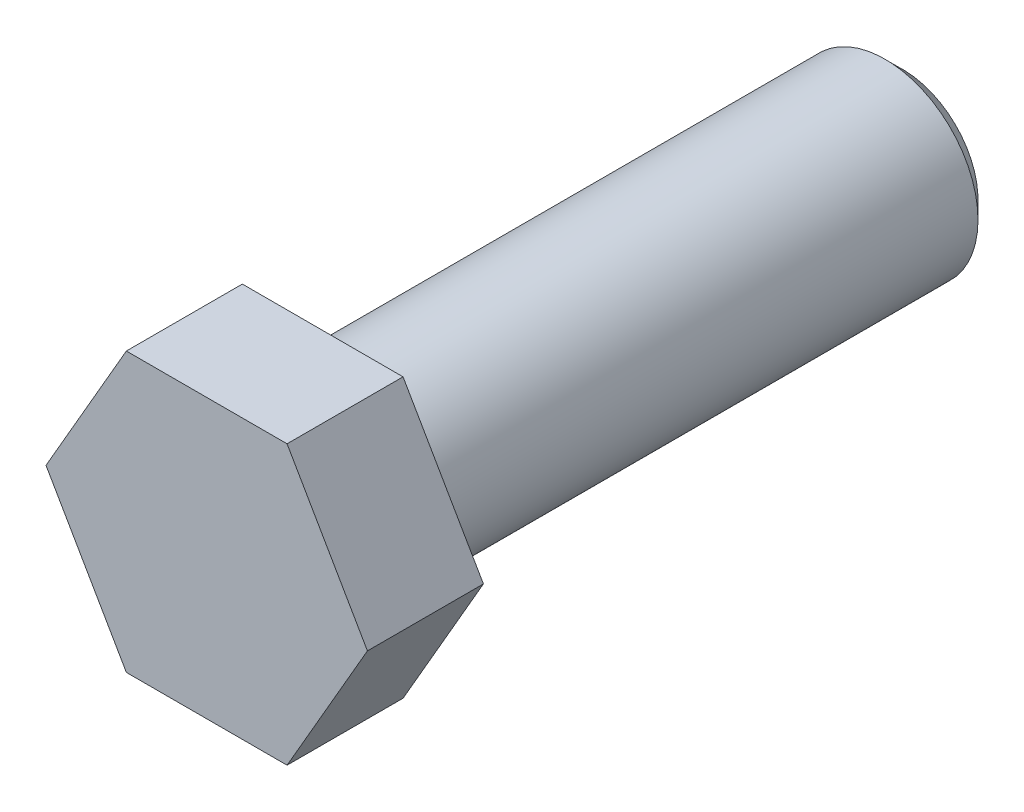
from build123d import *

# Parameters (mm, degrees)
BASE_EXTRUDE_DEPTH  = 10
SKETCH3_R           = 8
BOSS_EXTRUDE1_DEPTH = 50
CHAMFER1_SIZE       = 1.5


with BuildPart() as part:
    # Sketch1 → Base-Extrude (new body)
    with BuildSketch(Plane.XY):
        Polygon((-6.92820323, 12), (6.92820323, 12), (13.856406461, 0), (6.92820323, -12), (-6.92820323, -12), (-13.856406461, 0), align=None)
    extrude(amount=BASE_EXTRUDE_DEPTH)

    # Sketch3 → Boss-Extrude1 (add)
    with BuildSketch(Plane(origin=(0, 0, 0), x_dir=(-1, 0, 0), z_dir=(0, 0, -1))):
        with Locations(Location((0, 0, 0), (0, 0, 180))):
            Circle(SKETCH3_R)
    extrude(amount=BOSS_EXTRUDE1_DEPTH)

    # Chamfer1
    chamfer1_edges = [part.edges().sort_by_distance(p)[0] for p in [
        (-8, 0, -50),
    ]]
    chamfer(chamfer1_edges, length=CHAMFER1_SIZE)


solid = part.part
